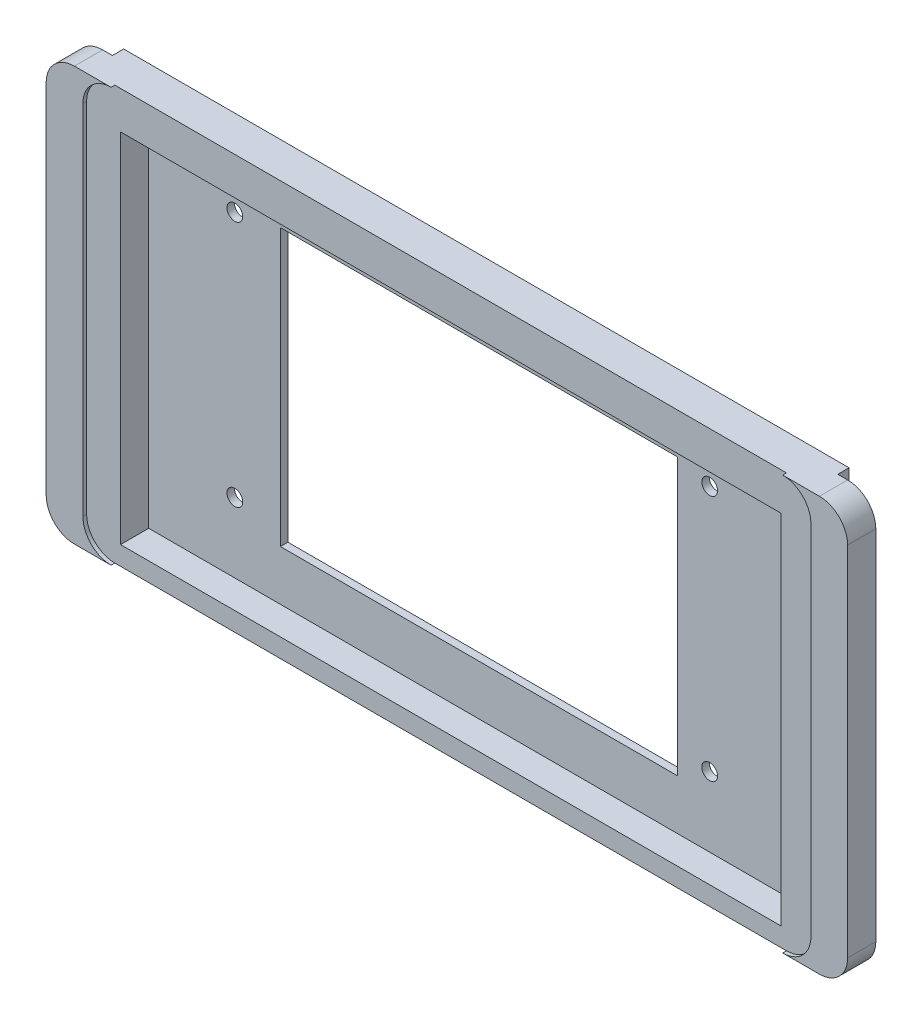
from build123d import *

# Parameters (mm, degrees)
BOSS_EXTRUDE1_DEPTH       = 10.5
CUT_EXTRUDE1_DEPTH        = 1
M5X0_8_TAPPED_HOLE1_D     = 4.2
M5X0_8_TAPPED_HOLE1_DEPTH = 12.4
M5X0_8_TAPPED_HOLE1_TIP   = 1.2618073
SKETCH7_W                 = 105.52
SKETCH7_H                 = 73.399079938
CUT_EXTRUDE2_DEPTH        = 121.239344642
SKETCH9_W                 = 175.5
SKETCH9_H                 = 95
CUT_EXTRUDE3_DEPTH        = 7.5
CUT_EXTRUDE4_START        = -3
CUT_EXTRUDE4_DEPTH        = 3


with BuildPart() as part:
    # Sketch1 → Boss-Extrude1 (new body)
    with BuildSketch(Plane.XY):
        with BuildLine():
            Line((-99, 55), (99, 55))
            ThreePointArc((99, 55), (104.303300859, 52.803300859), (106.5, 47.5))
            Line((106.5, 47.5), (106.5, -47.5))
            ThreePointArc((106.5, -47.5), (104.303300859, -52.803300859), (99, -55))
            Line((99, -55), (-99, -55))
            ThreePointArc((-99, -55), (-104.303300859, -52.803300859), (-106.5, -47.5))
            Line((-106.5, -47.5), (-106.5, 47.5))
            ThreePointArc((-106.5, 47.5), (-104.303300859, 52.803300859), (-99, 55))
        make_face()
    extrude(amount=-BOSS_EXTRUDE1_DEPTH)

    # Sketch2 → Cut-Extrude1 (cut)
    with BuildSketch(Plane.XY):
        with BuildLine():
            Line((-89.25, 55), (89.25, 55))
            ThreePointArc((89.25, 55), (94.553300859, 52.803300859), (96.75, 47.5))
            Line((96.75, 47.5), (96.75, -47.5))
            ThreePointArc((96.75, -47.5), (94.553300859, -52.803300859), (89.25, -55))
            Line((89.25, -55), (-89.25, -55))
            ThreePointArc((-89.25, -55), (-94.553300859, -52.803300859), (-96.75, -47.5))
            Line((-96.75, -47.5), (-96.75, 47.5))
            ThreePointArc((-96.75, 47.5), (-94.553300859, 52.803300859), (-89.25, 55))
        make_face()
    extrude(amount=-CUT_EXTRUDE1_DEPTH, mode=Mode.SUBTRACT)

    # M5x0.8 Tapped Hole1
    with Locations(Plane.XY.offset(-1)):
        with Locations((-64.86, 34.2), (61.34, 34.2), (61.34, -31.45), (-64.86, -31.45)):
            Hole(M5X0_8_TAPPED_HOLE1_D / 2, depth=M5X0_8_TAPPED_HOLE1_DEPTH)
            with Locations((0, 0, -(M5X0_8_TAPPED_HOLE1_DEPTH + M5X0_8_TAPPED_HOLE1_TIP / 2))):  # 118° drill point
                Cone(0, M5X0_8_TAPPED_HOLE1_D / 2, M5X0_8_TAPPED_HOLE1_TIP, mode=Mode.SUBTRACT)

    # Sketch7 → Cut-Extrude2 (cut, through all)
    with BuildSketch(Plane.XY.offset(-1)):
        Rectangle(SKETCH7_W, SKETCH7_H)
    extrude(amount=-CUT_EXTRUDE2_DEPTH, mode=Mode.SUBTRACT)

    # Sketch9 → Cut-Extrude3 (cut)
    with BuildSketch(Plane.XY.offset(-1)):
        with Locations((0, -2.5)):
            Rectangle(SKETCH9_W, SKETCH9_H)
    extrude(amount=-CUT_EXTRUDE3_DEPTH, mode=Mode.SUBTRACT)

    # Sketch10 → Cut-Extrude4 (cut)
    with BuildSketch(Plane(origin=(0, 0, -10.5), x_dir=(-1, 0, 0), z_dir=(0, 0, -1)).offset(CUT_EXTRUDE4_START)):
        with BuildLine():
            Line((-96.4, 55), (-99, 55))
            ThreePointArc((-99, 55), (-104.303300859, 52.803300859), (-106.5, 47.5))
            Line((-106.5, 47.5), (-106.5, -47.5))
            ThreePointArc((-106.5, -47.5), (-104.303300859, -52.803300859), (-99, -55))
            Line((-99, -55), (-96.4, -55))
            Line((-96.4, -55), (-96.4, 55))
        make_face()
        with BuildLine():
            Line((96.4, -55), (99, -55))
            ThreePointArc((99, -55), (104.303300859, -52.803300859), (106.5, -47.5))
            Line((106.5, -47.5), (106.5, 47.5))
            ThreePointArc((106.5, 47.5), (104.303300859, 52.803300859), (99, 55))
            Line((99, 55), (96.4, 55))
            Line((96.4, 55), (96.4, -55))
        make_face()
    extrude(amount=CUT_EXTRUDE4_DEPTH, mode=Mode.SUBTRACT)


solid = part.part
